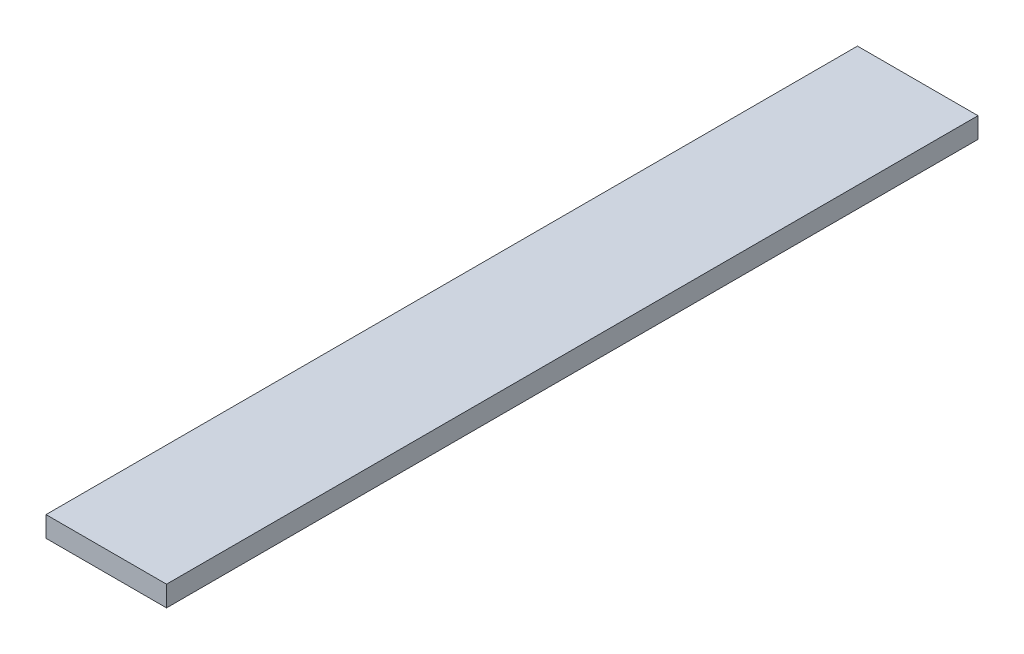
from build123d import *

# Parameters (mm, degrees)
ESBO_O1_W                = 95.8
ESBO_O1_H                = 16.35
RESSALTO_EXTRUS_O1_DEPTH = 645


with BuildPart() as part:
    # Esboço1 → Ressalto-extrusão1 (new body)
    with BuildSketch(Plane.XY):
        Rectangle(ESBO_O1_W, ESBO_O1_H)
    extrude(amount=RESSALTO_EXTRUS_O1_DEPTH)


solid = part.part
